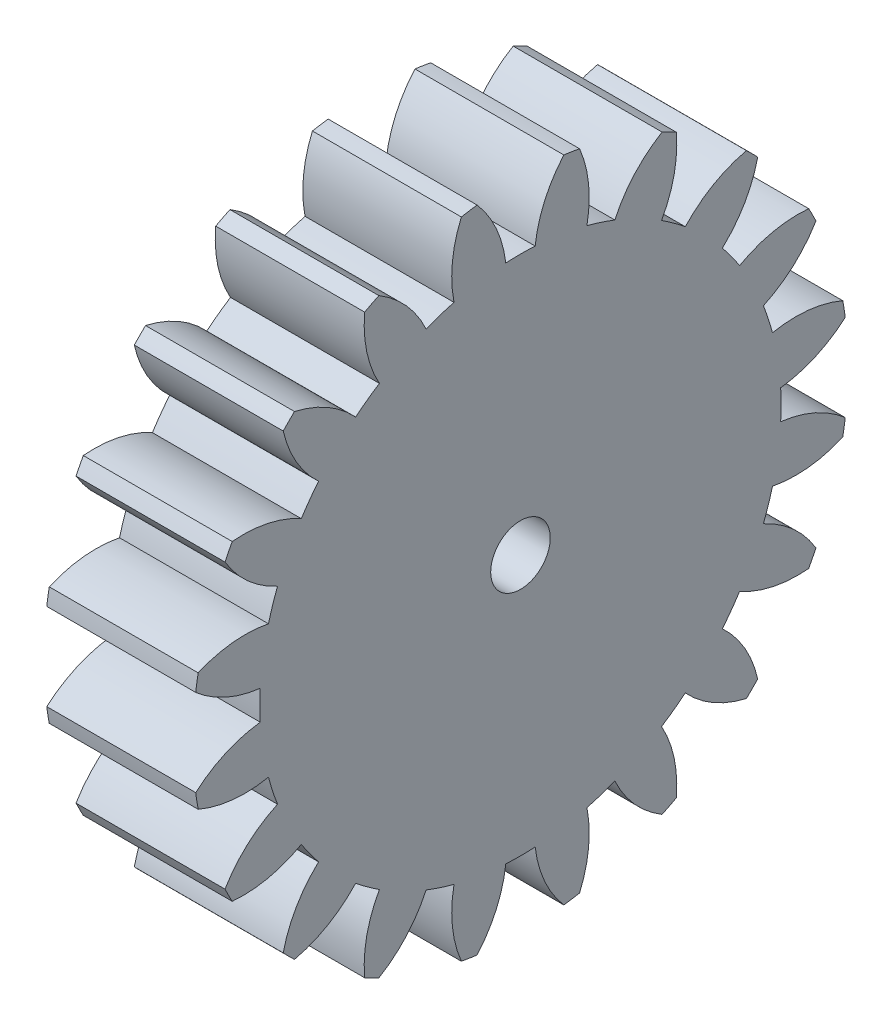
from build123d import *

# Parameters (mm, degrees)
BASPROSKE_W     = 10
BASPROSKE_H     = 22
TOOTHCUT_DEPTH  = 33.680269277
TEETHCUTS_COUNT = 20
TEETHCUTS_ANGLE = 342
BORSKE_R        = 2
BORE_DEPTH      = 50.0000508


with BuildPart() as part:
    # BasProSke → Base-Revolve (revolve)
    with BuildSketch(Plane(origin=(0, 0, 0), x_dir=(1, 0, 0), z_dir=(0, 1, 0)), mode=Mode.PRIVATE) as base_revolve_sk:
        with Locations((5, 11)):
            Rectangle(BASPROSKE_W, BASPROSKE_H)
    revolve(base_revolve_sk.sketch.rotate(Axis((-10, 0, 0), (1, 0, 0)), 180), axis=Axis((-10, 0, 0), (1, 0, 0)))

    # TooCutSke → ToothCut (cut, through all)
    with BuildSketch(Plane(origin=(0, 0, 0), x_dir=(0, 0, -1), z_dir=(1, 0, 0))):
        with BuildLine():
            ThreePointArc((0.986171591, 17.471189616), (0, 17.499), (-0.986171591, 17.471189616))
            ThreePointArc((-0.986171591, 17.471189616), (-1.626916196, 19.798789858), (-2.932850173, 21.829260982))
            ThreePointArc((-2.932850173, 21.829260982), (0, 22.0254), (2.932850173, 21.829260982))
            ThreePointArc((2.932850173, 21.829260982), (1.626916196, 19.798789858), (0.986171591, 17.471189616))
        make_face()
    toothcut = extrude(amount=TOOTHCUT_DEPTH, mode=Mode.SUBTRACT)

    # TeethCuts: ToothCut ×20 about axis
    teethcuts_axis = Axis((-10, 0, 0), (1, 0, 0))
    for i in range(1, TEETHCUTS_COUNT):
        add(toothcut.rotate(teethcuts_axis, i * TEETHCUTS_ANGLE / (TEETHCUTS_COUNT - 1)), mode=Mode.SUBTRACT)

    # BorSke → Bore (cut, symmetric)
    with BuildSketch(Plane(origin=(0, 0, 0), x_dir=(0, 0, -1), z_dir=(1, 0, 0))):
        with Locations(Location((0, 0, 0), (0, 0, 180))):
            Circle(BORSKE_R)
    extrude(amount=BORE_DEPTH, both=True, mode=Mode.SUBTRACT)


solid = part.part
